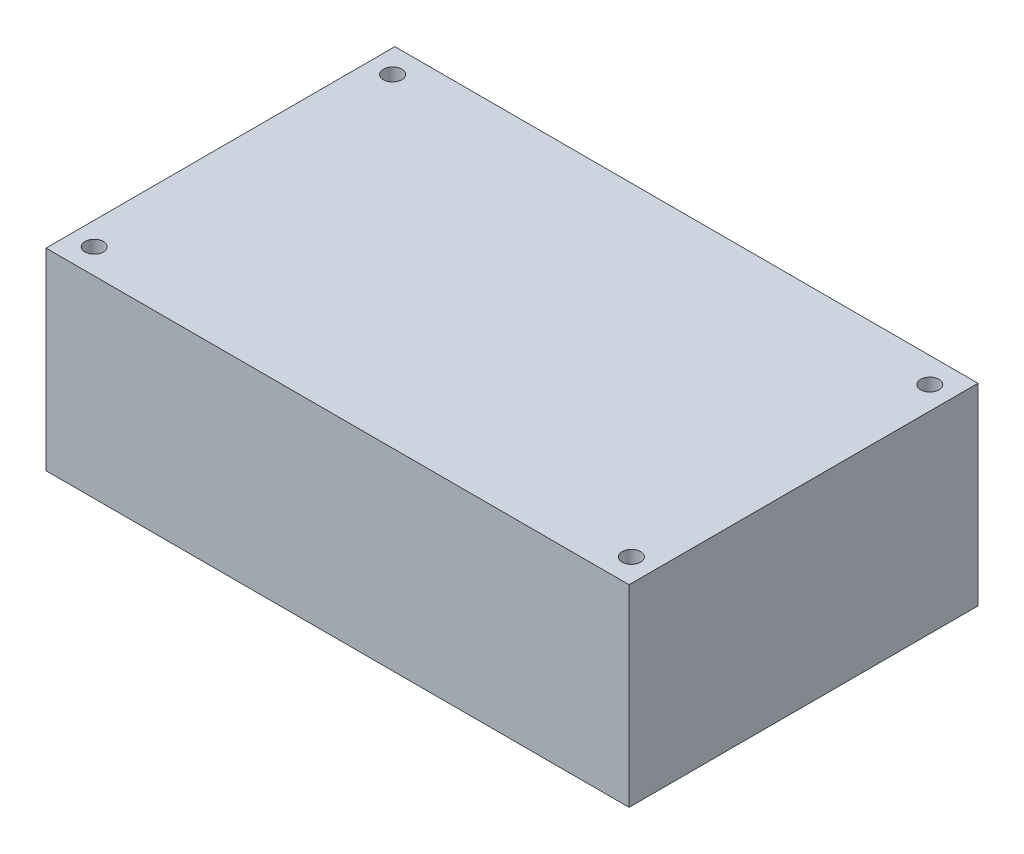
from build123d import *

# Parameters (mm, degrees)
SKETCH1_W           = 127
SKETCH1_H           = 76
BOSS_EXTRUDE1_DEPTH = 42
SKETCH2_R           = 2
CUT_EXTRUDE1_DEPTH  = 86.089658596


with BuildPart() as part:
    # Sketch1 → Boss-Extrude1 (new body)
    with BuildSketch(Plane(origin=(0, 0, 0), x_dir=(1, 0, 0), z_dir=(0, 1, 0))):
        Rectangle(SKETCH1_W, SKETCH1_H)
    extrude(amount=BOSS_EXTRUDE1_DEPTH)

    # Sketch2 → Cut-Extrude1 (cut, through all)
    with BuildSketch(Plane(origin=(0, 42, 0), x_dir=(1, 0, 0), z_dir=(0, 1, 0))):
        with Locations(Location((-58.5, 32.5, 0), (0, 0, 270))):
            Circle(SKETCH2_R)
        with Locations(Location((58.5, 32.5, 0), (0, 0, 270))):
            Circle(SKETCH2_R)
        with Locations(Location((58.5, -32.5, 0), (0, 0, 270))):
            Circle(SKETCH2_R)
        with Locations(Location((-58.5, -32.5, 0), (0, 0, 270))):
            Circle(SKETCH2_R)
    extrude(amount=-CUT_EXTRUDE1_DEPTH, mode=Mode.SUBTRACT)


solid = part.part
